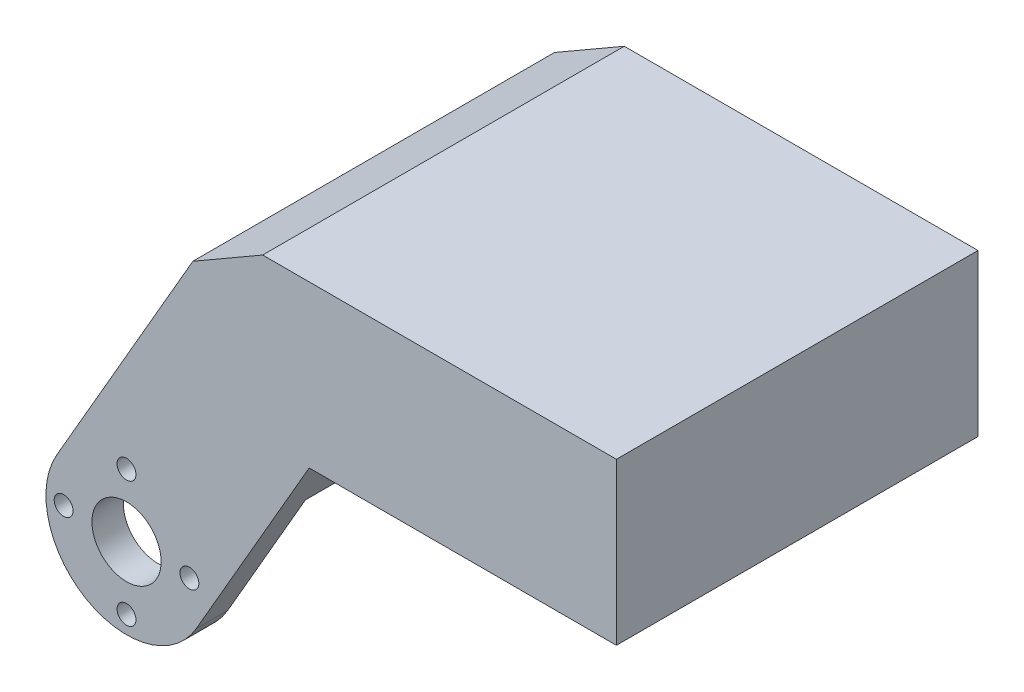
from build123d import *

# Parameters (mm, degrees)
SKETCH1_R           = 1.2
SKETCH1_R_2         = 4.4
BOSS_EXTRUDE1_DEPTH = 46
SKETCH4_W           = 38
SKETCH4_H           = 30
CUT_EXTRUDE1_DEPTH  = 46


with BuildPart() as part:
    # Sketch1 → Boss-Extrude1 (new body)
    with BuildSketch(Plane.XY):
        with BuildLine():
            Line((8.443747687, 35.125), (-8.876760389, 5.125))
            ThreePointArc((-8.876760389, 5.125), (-5.125, -8.876760389), (8.876760389, -5.125))
            Line((8.876760389, -5.125), (23.238348335, 19.75))
            Line((23.238348335, 19.75), (62.320508076, 19.75))
            Line((62.320508076, 19.75), (62.320508076, 40.25))
            Line((62.320508076, 40.25), (17.320508076, 40.25))
            Line((17.320508076, 40.25), (8.443747687, 35.125))
        make_face()
        with Locations((0, -8)):
            Circle(SKETCH1_R, mode=Mode.SUBTRACT)
        Circle(SKETCH1_R_2, mode=Mode.SUBTRACT)
        with Locations((8, 0)):
            Circle(SKETCH1_R, mode=Mode.SUBTRACT)
        with Locations((-8, 0)):
            Circle(SKETCH1_R, mode=Mode.SUBTRACT)
        with Locations((0, 8)):
            Circle(SKETCH1_R, mode=Mode.SUBTRACT)
    extrude(amount=-BOSS_EXTRUDE1_DEPTH)

    # Sketch4 → Cut-Extrude1 (cut)
    with BuildSketch(Plane(origin=(-8.876760389, 5.125, 0), x_dir=(0, 0, 1), z_dir=(-0.8660254037844382, 0.5000000000000009, 0))):
        with Locations((-23, 4.75)):
            Rectangle(SKETCH4_W, SKETCH4_H)
    extrude(amount=-CUT_EXTRUDE1_DEPTH, mode=Mode.SUBTRACT)


solid = part.part
